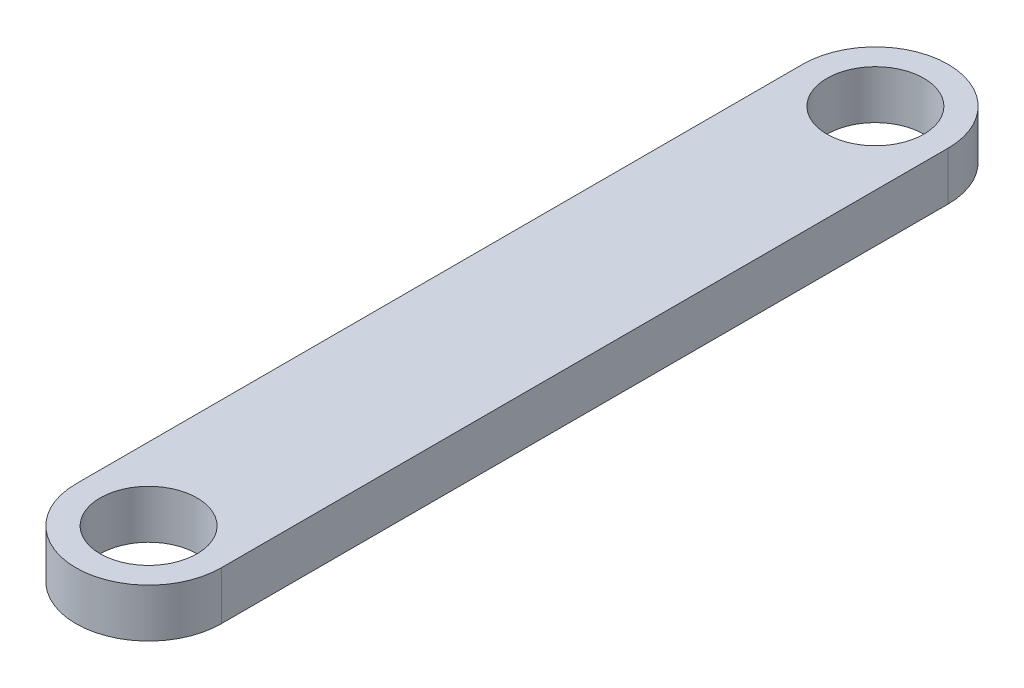
from build123d import *

# Parameters (mm, degrees)
SKETCH1_R           = 2
BOSS_EXTRUDE1_DEPTH = 2


with BuildPart() as part:
    # Sketch1 → Boss-Extrude1 (new body)
    with BuildSketch(Plane(origin=(0, 0, 0), x_dir=(1, 0, 0), z_dir=(0, 1, 0))):
        with BuildLine():
            Line((-3, 0), (-3, 30))
            ThreePointArc((-3, 30), (0, 33), (3, 30))
            Line((3, 30), (3, 0))
            ThreePointArc((3, 0), (0, -3), (-3, 0))
        make_face()
        with Locations(Location((0, 30, 0), (0, 0, 270))):
            Circle(SKETCH1_R, mode=Mode.SUBTRACT)
        with Locations(Location((0, 0, 0), (0, 0, 270))):
            Circle(SKETCH1_R, mode=Mode.SUBTRACT)
    extrude(amount=BOSS_EXTRUDE1_DEPTH)


solid = part.part
